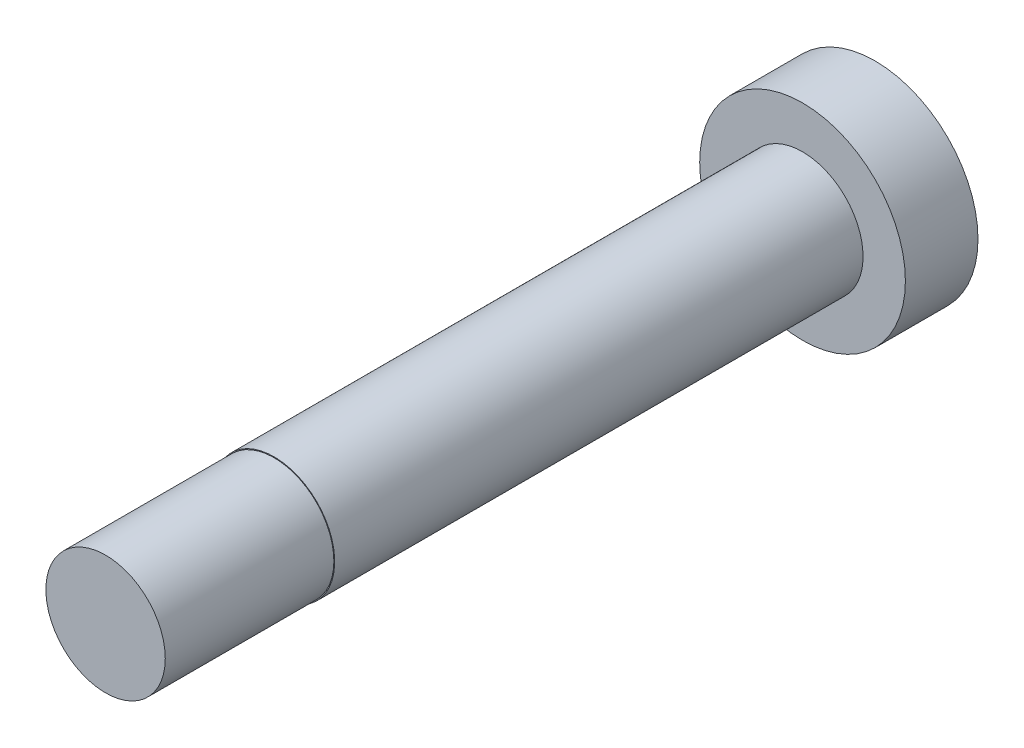
from build123d import *

# Parameters (mm, degrees)
F_01_START                  = -1.8
S01_LOW_PROFILE_HEAD_R      = 2.55
F_01_LOW_PROFILE_HEAD_DEPTH = 1.8
S02_SMOOTH_JOURNAL_R        = 1.5
F_02_SMOOTH_JOURNAL_DEPTH   = 13.1
F_03_START                  = 13.1
S03_M3_THREADED_TIP_R       = 1.48
F_03_M3_THREADED_TIP_DEPTH  = 4.18
F_04_START                  = -1.9
F_04_HEX_SOCKET_DEPTH       = 1.05


with BuildPart() as part:
    # S01 - Low profile head → 01 - Low profile head (new body)
    with BuildSketch(Plane.XY.offset(F_01_START)):
        Circle(S01_LOW_PROFILE_HEAD_R)
    extrude(amount=F_01_LOW_PROFILE_HEAD_DEPTH)

    # S02 - Smooth journal → 02 - Smooth journal (add)
    with BuildSketch(Plane.XY):
        with Locations(Location((0, 0, 0), (0, 0, 180))):
            Circle(S02_SMOOTH_JOURNAL_R)
    extrude(amount=F_02_SMOOTH_JOURNAL_DEPTH)

    # S03 - M3 threaded tip → 03 - M3 threaded tip (add)
    with BuildSketch(Plane.XY.offset(F_03_START)):
        Circle(S03_M3_THREADED_TIP_R)
    extrude(amount=F_03_M3_THREADED_TIP_DEPTH)

    # S04 - Hex socket → 04 - Hex socket (cut)
    with BuildSketch(Plane.XY.offset(F_04_START)):
        Polygon((0.995929214, 0.575), (0, 1.15), (-0.995929214, 0.575), (-0.995929214, -0.575), (0, -1.15), (0.995929214, -0.575), align=None)
    extrude(amount=F_04_HEX_SOCKET_DEPTH, mode=Mode.SUBTRACT)


solid = part.part
